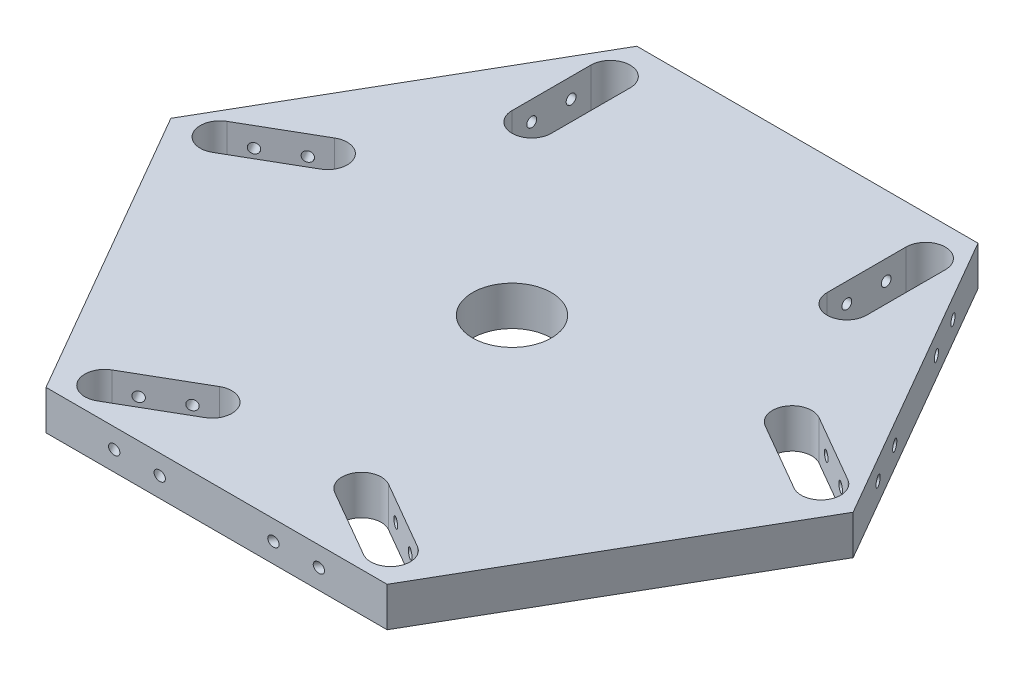
from build123d import *

# Parameters (mm, degrees)
BOSS_EXTRUDE1_DEPTH     = 10
CUT_EXTRUDE1_DEPTH      = 20
SKETCH4_R               = 1.25
CUT_EXTRUDE2_DEPTH      = 149.417392118
CUT_EXTRUDE3_DEPTH      = 116
CUT_EXTRUDE3_DEPTH_BACK = 116
SKETCH6_R               = 10
CIRPATTERN1_COUNT       = 3


with BuildPart() as part:
    # Sketch1 → Boss-Extrude1 (new body)
    with BuildSketch(Plane(origin=(0, 0, 0), x_dir=(1, 0, 0), z_dir=(0, 1, 0))):
        Polygon((-43.301270189, -75), (43.301270189, -75), (86.602540378, 0), (43.301270189, 75), (-43.301270189, 75), (-86.602540378, 0), align=None)
    extrude(amount=BOSS_EXTRUDE1_DEPTH)

    # Sketch3 → Cut-Extrude1 (cut)
    with BuildSketch(Plane(origin=(0, 10, 0), x_dir=(1, 0, 0), z_dir=(0, 1, 0))):
        with BuildLine():
            Line((-78.791651246, 6.47114317), (-61.47114317, 16.47114317))
            ThreePointArc((-61.47114317, 16.47114317), (-54.641016151, 14.641016151), (-56.47114317, 7.810889132))
            Line((-56.47114317, 7.810889132), (-73.791651246, -2.189110868))
            ThreePointArc((-73.791651246, -2.189110868), (-80.621778265, -0.358983849), (-78.791651246, 6.47114317))
        make_face()
        with BuildLine():
            Line((-38.791651246, -62.810889132), (-21.47114317, -52.810889132))
            ThreePointArc((-21.47114317, -52.810889132), (-14.641016151, -54.641016151), (-16.47114317, -61.47114317))
            Line((-16.47114317, -61.47114317), (-33.791651246, -71.47114317))
            ThreePointArc((-33.791651246, -71.47114317), (-40.621778265, -69.641016151), (-38.791651246, -62.810889132))
        make_face()
    cut_extrude1 = extrude(amount=-CUT_EXTRUDE1_DEPTH, mode=Mode.SUBTRACT)

    # Sketch4 → Cut-Extrude2 (cut, symmetric)
    with BuildSketch(Plane(origin=(17.5, 0, 30.310889132), x_dir=(0.8660254037844383, 0, -0.5000000000000007), z_dir=(0.5000000000000007, 0, 0.8660254037844383))):
        with Locations((-60, 5)):
            Circle(SKETCH4_R)
        with Locations((-50, 5)):
            Circle(SKETCH4_R)
    cut_extrude2 = extrude(amount=CUT_EXTRUDE2_DEPTH, both=True, mode=Mode.SUBTRACT)

    # Sketch6 → Cut-Extrude3 (cut, two sides: drawn at the far end of the back side and taken through both)
    with BuildSketch(Plane(origin=(0, 10, 0), x_dir=(1, 0, 0), z_dir=(0, 1, 0)).offset(-CUT_EXTRUDE3_DEPTH_BACK)):
        with Locations(Location((0, 0, 0), (0, 0, 270))):
            Circle(SKETCH6_R)
    extrude(amount=CUT_EXTRUDE3_DEPTH + CUT_EXTRUDE3_DEPTH_BACK, mode=Mode.SUBTRACT)

    # CirPattern1: Cut-Extrude1, Cut-Extrude2 ×3 about axis
    cirpattern1_axis = Axis((0, 0, 0), (0, 1, 0))
    add([cut_extrude1.rotate(cirpattern1_axis, i * 360 / CIRPATTERN1_COUNT) for i in range(1, CIRPATTERN1_COUNT)], mode=Mode.SUBTRACT)
    add([cut_extrude2.rotate(cirpattern1_axis, i * 360 / CIRPATTERN1_COUNT) for i in range(1, CIRPATTERN1_COUNT)], mode=Mode.SUBTRACT)


solid = part.part
